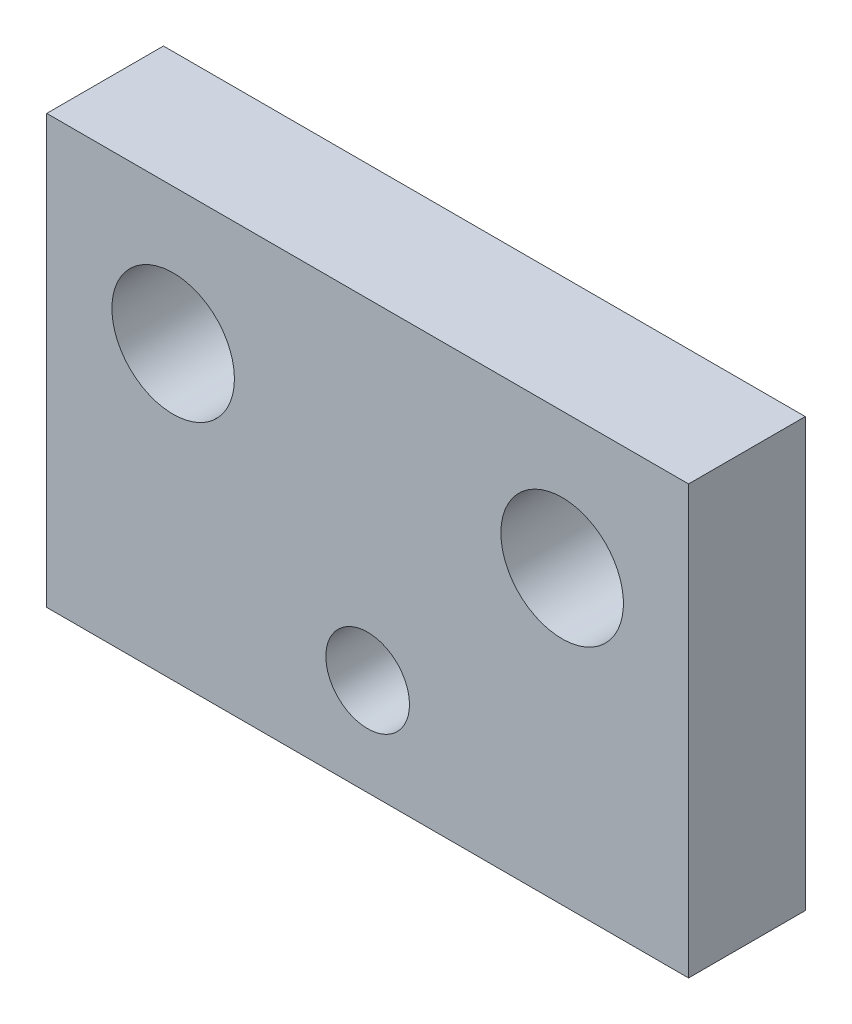
from build123d import *

# Parameters (mm, degrees)
SKETCH_1_W          = 33
SKETCH_1_H          = 22
EXTRUDE_1_DEPTH     = 6
SKETCH_2_R          = 3.15
SKETCH_2_R_2        = 2.15
CUT_EXTRUDE_1_DEPTH = 6


with BuildPart() as part:
    # 草图1 → 凸台-拉伸1 (new body)
    with BuildSketch(Plane.XY):
        with Locations((0, 11)):
            Rectangle(SKETCH_1_W, SKETCH_1_H)
    extrude(amount=EXTRUDE_1_DEPTH)

    # 草图2 → 切除-拉伸1 (cut)
    with BuildSketch(Plane.XY):
        with Locations((-10, 15)):
            Circle(SKETCH_2_R)
        with Locations((0, 5)):
            Circle(SKETCH_2_R_2)
        with Locations(Location((10, 15, 0), (0, 0, 180))):
            Circle(SKETCH_2_R)
    extrude(amount=CUT_EXTRUDE_1_DEPTH, mode=Mode.SUBTRACT)


solid = part.part
